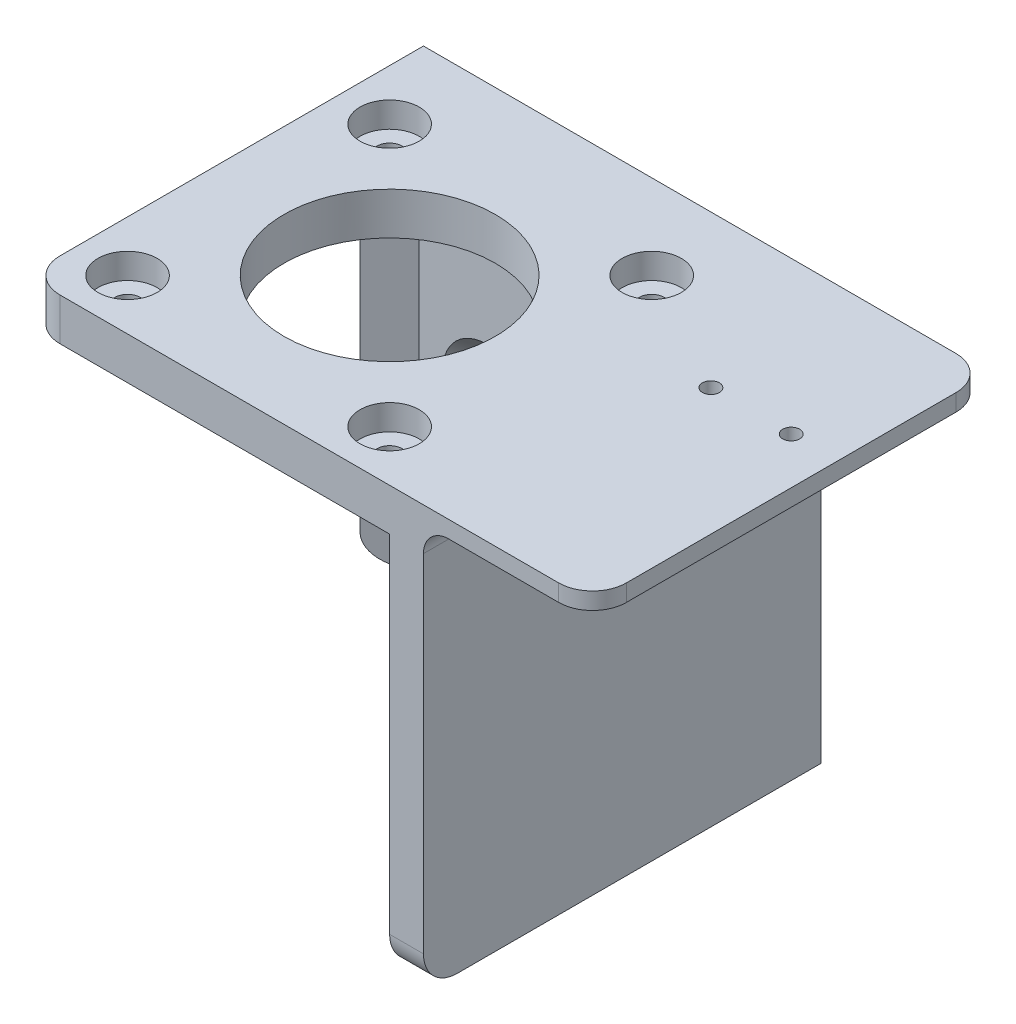
from build123d import *

# Parameters (mm, degrees)
SKETCH_2_W                  = 47
SKETCH_2_H                  = 47
EXTRUDE_1_DEPTH             = 4
SKETCH_3_W                  = 47
SKETCH_3_H                  = 2
EXTRUDE_2_DEPTH             = 43
SKETCH_4_W                  = 4
SKETCH_4_H                  = 45
EXTRUDE_3_DEPTH             = 43
SKETCH_5_R                  = 12.5
CUT_EXTRUDE_1_DEPTH         = 81.268300094
M3X0_5_2_D                  = 3
HOLE_WIZARD_M5_1_AT_2_COUNT = 2
HOLE_WIZARD_M5_1_AT_2_PITCH = 14.142135624
HOLE_WIZARD_M5_1_AT_3_COUNT = 2
HOLE_WIZARD_M5_1_AT_3_PITCH = 20
HOLE_WIZARD_M5_1_AT_4_COUNT = 2
HOLE_WIZARD_M5_1_AT_4_PITCH = 14.142135624
EXTRUDE_6_DEPTH             = 45
EXTRUDE_7_DEPTH             = 45
SKETCH_23_W                 = 67
SKETCH_23_H                 = 47
SKETCH_23_R                 = 3.5
SKETCH_23_R_2               = 12.5
EXTRUDE_10_DEPTH            = 3
M2X0_4_1_D                  = 2
SKETCH_27_W                 = 47
SKETCH_27_H                 = 1
CUT_EXTRUDE_2_DEPTH         = 20
FILLET_1_R                  = 2.5
FILLET_2_R                  = 4
SKETCH_29_W                 = 47
SKETCH_29_H                 = 2
EXTRUDE_11_DEPTH            = 20
FILLET_5_R                  = 4
FILLET_6_R                  = 3
M2X0_4_2_D                  = 2
SKETCH_34_W                 = 20
SKETCH_34_H                 = 47
CUT_EXTRUDE_5_DEPTH         = 20
FILLET_7_R                  = 4


with BuildPart() as part:
    # ｽｹｯﾁ2 → ﾎﾞｽ - 押し出し1 (new body)
    with BuildSketch(Plane.XY):
        with Locations((23.5, 23.5)):
            Rectangle(SKETCH_2_W, SKETCH_2_H)
    extrude(amount=EXTRUDE_1_DEPTH)

    # ｽｹｯﾁ3 → ﾎﾞｽ - 押し出し2 (add)
    with BuildSketch(Plane.XY.offset(4)):
        with Locations((23.5, 46)):
            Rectangle(SKETCH_3_W, SKETCH_3_H)
    extrude(amount=EXTRUDE_2_DEPTH)

    # ｽｹｯﾁ4 → ﾎﾞｽ - 押し出し3 (add)
    with BuildSketch(Plane.XY.offset(4)):
        with Locations((45, 22.5)):
            Rectangle(SKETCH_4_W, SKETCH_4_H)
    extrude(amount=EXTRUDE_3_DEPTH)

    # ｽｹｯﾁ5 → ｶｯﾄ - 押し出し1 (cut, through all)
    with BuildSketch(Plane.XZ.offset(-45)):
        with Locations(Location((21.5, 25.5, 0), (0, 0, 270))):
            Circle(SKETCH_5_R)
    extrude(amount=-CUT_EXTRUDE_1_DEPTH, mode=Mode.SUBTRACT)

    # M3x0.5 ねじ穴2 (through all)
    with Locations(Plane(origin=(0, 47, 0), x_dir=(1, 0, 0), z_dir=(0, 1, 0))):
        with Locations((6, -10), (37, -10), (37, -41), (6, -41)):
            Hole(M3X0_5_2_D / 2)

    # ｽｹｯﾁ14 → M5 平皿頭ねじ用皿穴1 (revolve, cut)
    with BuildSketch(Plane(origin=(11.5, 22, 4), x_dir=(0, -1, 0), z_dir=(1, 0, 0))):
        Polygon((0, 0), (0, 4), (2.75, 4), (2.75, 2.45), (5.2, 0), align=None)
    hole_wizard_m5_1 = revolve(axis=Axis((11.5, 22, 10.35), (0, 0, -1)), mode=Mode.SUBTRACT)

    # M5 平皿頭ねじ用皿穴1 at 2: M5 平皿頭ねじ用皿穴1 ×2
    with Locations(*[Vector(0.7071067811865475, 0.7071067811865476, 0) * (i * HOLE_WIZARD_M5_1_AT_2_PITCH) for i in range(1, HOLE_WIZARD_M5_1_AT_2_COUNT)]):
        add(hole_wizard_m5_1, mode=Mode.SUBTRACT)

    # M5 平皿頭ねじ用皿穴1 at 3: M5 平皿頭ねじ用皿穴1 ×2
    with Locations(*[(i * HOLE_WIZARD_M5_1_AT_3_PITCH, 0, 0) for i in range(1, HOLE_WIZARD_M5_1_AT_3_COUNT)]):
        add(hole_wizard_m5_1, mode=Mode.SUBTRACT)

    # M5 平皿頭ねじ用皿穴1 at 4: M5 平皿頭ねじ用皿穴1 ×2
    with Locations(*[Vector(0.7071067811865474, -0.7071067811865478, 0) * (i * HOLE_WIZARD_M5_1_AT_4_PITCH) for i in range(1, HOLE_WIZARD_M5_1_AT_4_COUNT)]):
        add(hole_wizard_m5_1, mode=Mode.SUBTRACT)

    # ｽｹｯﾁ17 → ﾎﾞｽ - 押し出し6 (add)
    with BuildSketch(Plane.XZ.offset(-45)):
        Polygon((43, 4), (39.5, 4), (43, 7.5), align=None)
    extrude(amount=EXTRUDE_6_DEPTH)

    # ｽｹｯﾁ19 → ﾎﾞｽ - 押し出し7 (add)
    with BuildSketch(Plane.XZ.offset(-45)):
        Polygon((0, 4), (3.5, 4), (0, 7.5), align=None)
    extrude(amount=EXTRUDE_7_DEPTH)

    # ｽｹｯﾁ23 → ﾎﾞｽ - 押し出し10 (add)
    with BuildSketch(Plane(origin=(0, 47, 0), x_dir=(1, 0, 0), z_dir=(0, 1, 0))):
        with Locations((13.5, -23.5)):
            Rectangle(SKETCH_23_W, SKETCH_23_H)
        with Locations(Location((6, -10, 0), (0, 0, 270))):
            Circle(SKETCH_23_R, mode=Mode.SUBTRACT)
        with Locations(Location((6, -41, 0), (0, 0, 270))):
            Circle(SKETCH_23_R, mode=Mode.SUBTRACT)
        with Locations(Location((37, -10, 0), (0, 0, 270))):
            Circle(SKETCH_23_R, mode=Mode.SUBTRACT)
        with Locations(Location((37, -41, 0), (0, 0, 270))):
            Circle(SKETCH_23_R, mode=Mode.SUBTRACT)
        with Locations(Location((21.5, -25.5, 0), (0, 0, 90))):
            Circle(SKETCH_23_R_2, mode=Mode.SUBTRACT)
    extrude(amount=EXTRUDE_10_DEPTH)

    # M2x0.4 ねじ穴1 (through all)
    with Locations(Plane(origin=(0, 50, 0), x_dir=(1, 0, 0), z_dir=(0, 1, 0))):
        with Locations((-5, -18), (-14.5, -18)):
            Hole(M2X0_4_1_D / 2)

    # ｽｹｯﾁ27 → ｶｯﾄ - 押し出し2 (cut)
    with BuildSketch(Plane.ZY.offset(20)):
        with Locations((23.5, 47.5)):
            Rectangle(SKETCH_27_W, SKETCH_27_H)
    extrude(amount=-CUT_EXTRUDE_2_DEPTH, mode=Mode.SUBTRACT)

    # ﾌｨﾚｯﾄ1
    fillet_1_edges = [part.edges().sort_by_distance(p)[0] for p in [
        (0, 48, 23.5),
    ]]
    fillet(fillet_1_edges, radius=FILLET_1_R)

    # ﾌｨﾚｯﾄ2
    fillet_2_edges = [part.edges().sort_by_distance(p)[0] for p in [
        (-20, 49, 47),
        (-20, 49, 0),
        (0, 0, 3.75),
        (45, 0, 47),
    ]]
    fillet(fillet_2_edges, radius=FILLET_2_R)

    # ｽｹｯﾁ29 → ﾎﾞｽ - 押し出し11 (add)
    with BuildSketch(Plane(origin=(47, 0, 0), x_dir=(0, 0, -1), z_dir=(1, 0, 0))):
        with Locations((-23.5, 49)):
            Rectangle(SKETCH_29_W, SKETCH_29_H)
    extrude(amount=EXTRUDE_11_DEPTH)

    # ﾌｨﾚｯﾄ5
    fillet_5_edges = [part.edges().sort_by_distance(p)[0] for p in [
        (67, 49, 0),
        (67, 49, 47),
    ]]
    fillet(fillet_5_edges, radius=FILLET_5_R)

    # ﾌｨﾚｯﾄ6
    fillet_6_edges = [part.edges().sort_by_distance(p)[0] for p in [
        (47, 48, 23.5),
    ]]
    fillet(fillet_6_edges, radius=FILLET_6_R)

    # M2x0.4 ねじ穴2 (through all)
    with Locations(Plane(origin=(0, 50, 0), x_dir=(1, 0, 0), z_dir=(0, 1, 0))):
        with Locations((61.5, -18), (52, -18)):
            Hole(M2X0_4_2_D / 2)

    # ｽｹｯﾁ34 → ｶｯﾄ - 押し出し5 (cut)
    with BuildSketch(Plane(origin=(0, 50, 0), x_dir=(1, 0, 0), z_dir=(0, 1, 0))):
        with Locations((-10, -23.5)):
            Rectangle(SKETCH_34_W, SKETCH_34_H)
    extrude(amount=-CUT_EXTRUDE_5_DEPTH, mode=Mode.SUBTRACT)

    # ﾌｨﾚｯﾄ7
    fillet_7_edges = [part.edges().sort_by_distance(p)[0] for p in [
        (0, 47.5, 47),
    ]]
    fillet(fillet_7_edges, radius=FILLET_7_R)


solid = part.part
